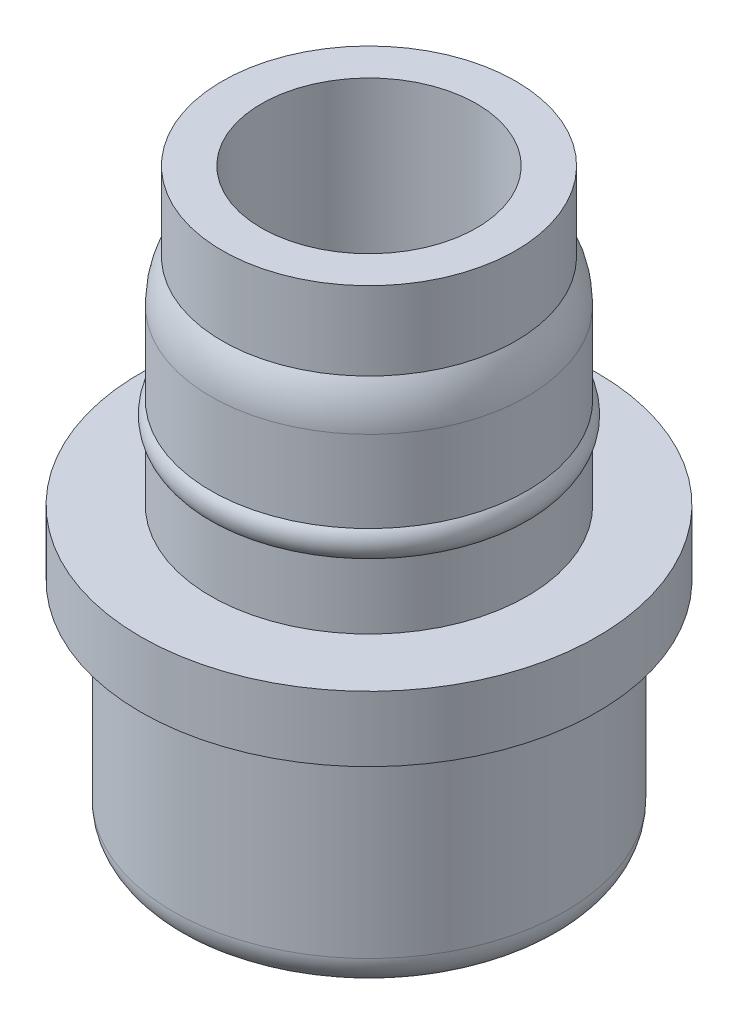
from build123d import *


with BuildPart() as part:
    # Sketch1 → Revolve1 (revolve)
    with BuildSketch(Plane.XY, mode=Mode.PRIVATE) as revolve1_sk:
        with BuildLine():
            Line((4.079215611, -1.9), (5, -1.9))
            ThreePointArc((5, -1.9), (5.707106781, -1.607106781), (6, -0.9))
            Line((6, -0.9), (6, 4.9))
            Line((6, 4.9), (7, 4.9))
            Line((7, 4.9), (7, 6.9))
            Line((7, 6.9), (4.85, 6.9))
            Line((4.85, 6.9), (4.85, 8.9))
            ThreePointArc((4.85, 8.9), (5, 9.3), (4.85, 9.7))
            Line((4.85, 9.7), (4.85, 12.2))
            ThreePointArc((4.85, 12.2), (4.760969375, 12.873145601), (4.5, 13.5))
            Line((4.5, 13.5), (4.5, 15.9))
            Line((4.5, 15.9), (3.3, 15.9))
            Line((3.3, 15.9), (3.3, 4.2))
            Line((3.3, 4.2), (1.615549442, 4.2))
            ThreePointArc((1.615549442, 4.2), (0.821583836, 4.424364361), (0, 4.5))
            Line((0, 4.5), (0, 4.2))
            Line((0, 4.2), (0, -4.5))
            ThreePointArc((0, -4.5), (2.418677324, -3.794733192), (4.079215611, -1.9))
        make_face()
    revolve(revolve1_sk.sketch.rotate(Axis((0, 0, 0), (0, 1, 0)), 90), axis=Axis((0, 0, 0), (0, 1, 0)))


solid = part.part
